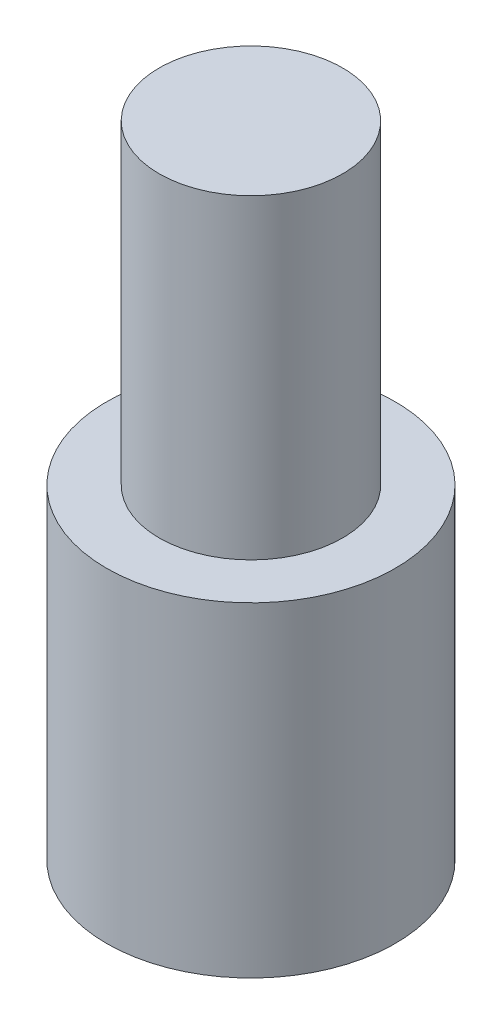
from build123d import *

# Parameters (mm, degrees)
SKETCH_1_R          = 7.55
EXTRUDE_1_DEPTH     = 17
SKETCH_2_R          = 5.15
CUT_EXTRUDE_1_DEPTH = 2
SKETCH_3_R          = 4.8
EXTRUDE_2_DEPTH     = 16.5


with BuildPart() as part:
    # 草图1 → 凸台-拉伸1 (new body)
    with BuildSketch(Plane(origin=(0, 0, 0), x_dir=(1, 0, 0), z_dir=(0, 1, 0))):
        with Locations(Location((-14.464315339, 6.751763544, 0), (0, 0, 270))):
            Circle(SKETCH_1_R)
    extrude(amount=EXTRUDE_1_DEPTH)

    # 草图2 → 切除-拉伸1 (cut)
    with BuildSketch(Plane.XZ):
        with Locations(Location((-14.464315339, -6.751763544, 0), (0, 0, 270))):
            Circle(SKETCH_2_R)
    extrude(amount=-CUT_EXTRUDE_1_DEPTH, mode=Mode.SUBTRACT)

    # 草图3 → 凸台-拉伸2 (add)
    with BuildSketch(Plane(origin=(0, 17, 0), x_dir=(1, 0, 0), z_dir=(0, 1, 0))):
        with Locations(Location((-14.464315339, 6.751763544, 0), (0, 0, 270))):
            Circle(SKETCH_3_R)
    extrude(amount=EXTRUDE_2_DEPTH)


solid = part.part
